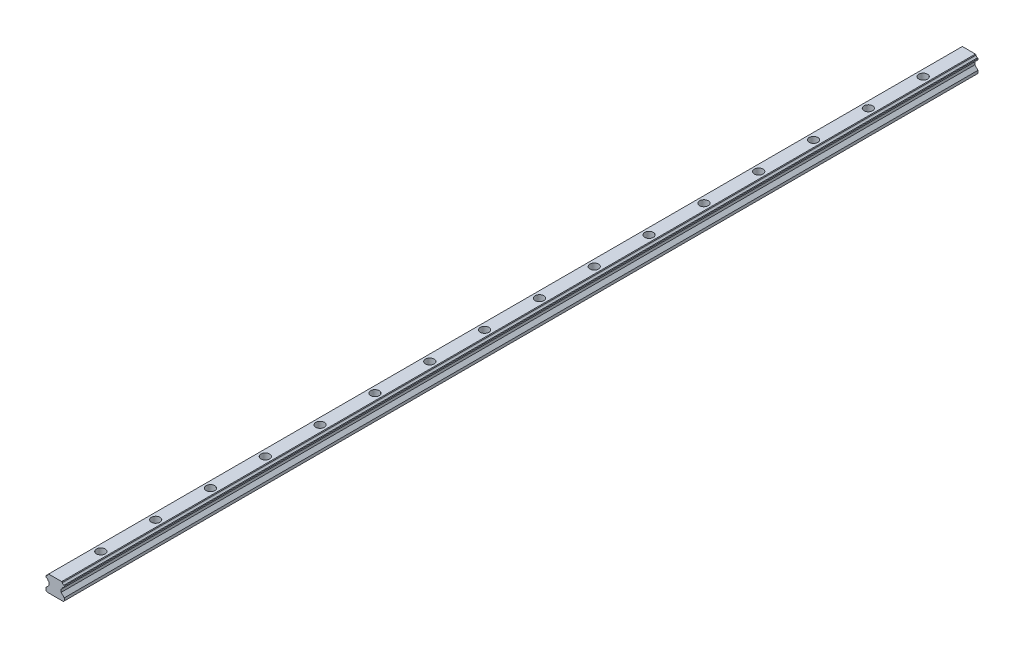
from build123d import *

# Parameters (mm, degrees)
BOSS_EXTRUDE1_DEPTH = 500
SKETCH2_R           = 3
CUT_EXTRUDE1_DEPTH  = 501.423820376
SKETCH3_R           = 4.75
CUT_EXTRUDE2_DEPTH  = 8.5
LPATTERN1_COUNT     = 100
LPATTERN1_PITCH     = 60


with BuildPart() as part:
    # Sketch1 → Boss-Extrude1 (new body)
    with BuildSketch(Plane.XY):
        with BuildLine():
            Line((-6.55, -4.115), (-6.55, -7.045))
            Line((-6.55, -7.045), (-10, -10.495))
            Line((-10, -10.495), (-10, -13.495))
            Line((-10, -13.495), (-9, -14.495))
            Line((-9, -14.495), (0, -14.495))
            Line((0, -14.495), (0, 3.505))
            Line((0, 3.505), (-7.16, 3.505))
            Line((-7.16, 3.505), (-7.768111832, 2.896888168))
            ThreePointArc((-7.768111832, 2.896888168), (-8.334356479, 1.761574733), (-9.469669914, 1.195330086))
            Line((-9.469669914, 1.195330086), (-10, 0.665))
            Line((-10, 0.665), (-10, -0.665))
            Line((-10, -0.665), (-9.469669914, -1.195330086))
            ThreePointArc((-9.469669914, -1.195330086), (-8.334356479, -1.761574733), (-7.768111832, -2.896888168))
            Line((-7.768111832, -2.896888168), (-6.55, -4.115))
        make_face()
    boss_extrude1 = extrude(amount=BOSS_EXTRUDE1_DEPTH)

    # Mirror1: Boss-Extrude1 across plane
    add(boss_extrude1.mirror(Plane(origin=(0, 3.505, 500), x_dir=(0, 0, 1), z_dir=(-1, 0, 0))))

    # Sketch2 → Cut-Extrude1 (cut, through all)
    with BuildSketch(Plane(origin=(0, 3.505, 0), x_dir=(1, 0, 0), z_dir=(0, 1, 0))):
        with Locations(Location((0, -30, 0), (0, 0, 270))):
            Circle(SKETCH2_R)
    cut_extrude1 = extrude(amount=-CUT_EXTRUDE1_DEPTH, mode=Mode.SUBTRACT)

    # Sketch3 → Cut-Extrude2 (cut)
    with BuildSketch(Plane(origin=(0, 3.505, 0), x_dir=(1, 0, 0), z_dir=(0, 1, 0))):
        with Locations(Location((0, -30, 0), (0, 0, 270))):
            Circle(SKETCH3_R)
    cut_extrude2 = extrude(amount=-CUT_EXTRUDE2_DEPTH, mode=Mode.SUBTRACT)

    # LPattern1: Cut-Extrude1, Cut-Extrude2 ×100
    with Locations(*[(0, 0, i * LPATTERN1_PITCH) for i in range(1, LPATTERN1_COUNT)]):
        add(cut_extrude1, mode=Mode.SUBTRACT)
        add(cut_extrude2, mode=Mode.SUBTRACT)

    # Mirror2: part across plane


with BuildPart() as part_1:
    add(part.part)
    add(part.part.mirror(Plane(origin=(-9.748570041, -3.175788295, 0), x_dir=(1, 0, 0), z_dir=(0, 0, -1))))


solid = part_1.part
